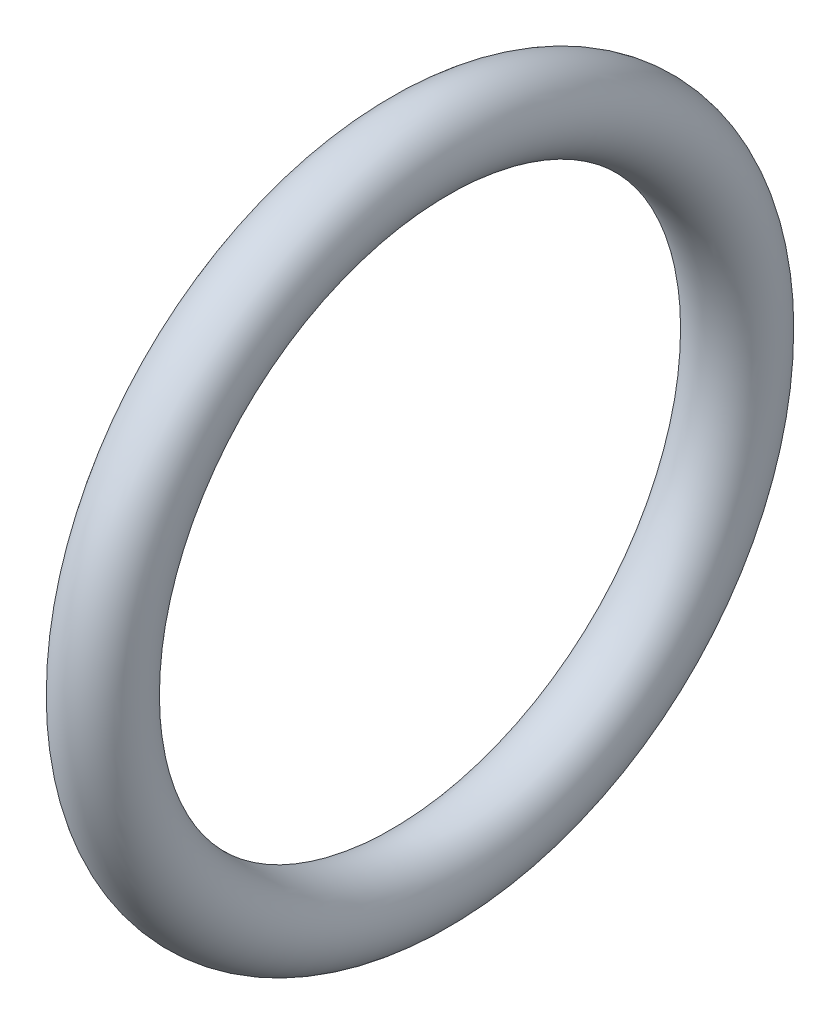
from build123d import *

# Parameters (mm, degrees)
SKETCH_1_R = 1.3


with BuildPart() as part:
    # 草图1 → 旋转1 (revolve)
    with BuildSketch(Plane.XY, mode=Mode.PRIVATE) as revolve_1_sk:
        with Locations((0, 10.3)):
            Circle(SKETCH_1_R)
    revolve(revolve_1_sk.sketch.rotate(Axis((8.706451217, 0, 0), (-1, 0, 0)), 90), axis=Axis((8.706451217, 0, 0), (-1, 0, 0)))


solid = part.part
